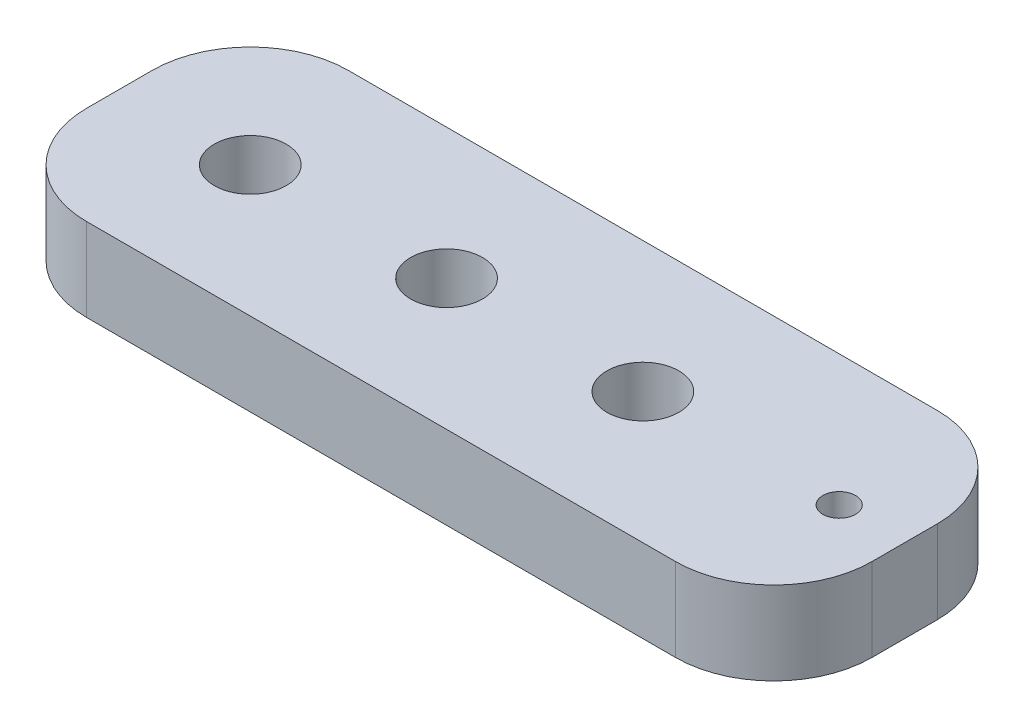
from build123d import *

# Parameters (mm, degrees)
SKETCH2_W                   = 60
SKETCH2_H                   = 20
BOSS_EXTRUDE1_DEPTH         = 6.35
M5_CLEARANCE_HOLE1_D        = 5.5
TAP_DRILL_FOR_M3X0_5_TAP1_D = 2.5
FILLET1_R                   = 7.5


with BuildPart() as part:
    # Sketch2 → Boss-Extrude1 (new body)
    with BuildSketch(Plane(origin=(0, 0, 0), x_dir=(1, 0, 0), z_dir=(0, 1, 0))):
        with Locations((30, 10)):
            Rectangle(SKETCH2_W, SKETCH2_H)
    extrude(amount=BOSS_EXTRUDE1_DEPTH)

    # M5 Clearance Hole1 (through all)
    with Locations(Plane(origin=(10, 6.35, -10), x_dir=(0, 0, 1), z_dir=(0, 1, 0))):
        with Locations((0, 0), (0, 15), (0, 30)):
            Hole(M5_CLEARANCE_HOLE1_D / 2)

    # Tap Drill for M3x0.5 Tap1 (through all)
    with Locations(Plane(origin=(55, 6.35, -10), x_dir=(0, 0, 1), z_dir=(0, 1, 0))):
        with Locations((0, 0)):
            Hole(TAP_DRILL_FOR_M3X0_5_TAP1_D / 2)

    # Fillet1
    fillet1_edges = [part.edges().sort_by_distance(p)[0] for p in [
        (0, 3.175, -20),
        (60, 3.175, -20),
        (60, 3.175, 0),
        (0, 3.175, 0),
    ]]
    fillet(fillet1_edges, radius=FILLET1_R)


solid = part.part
